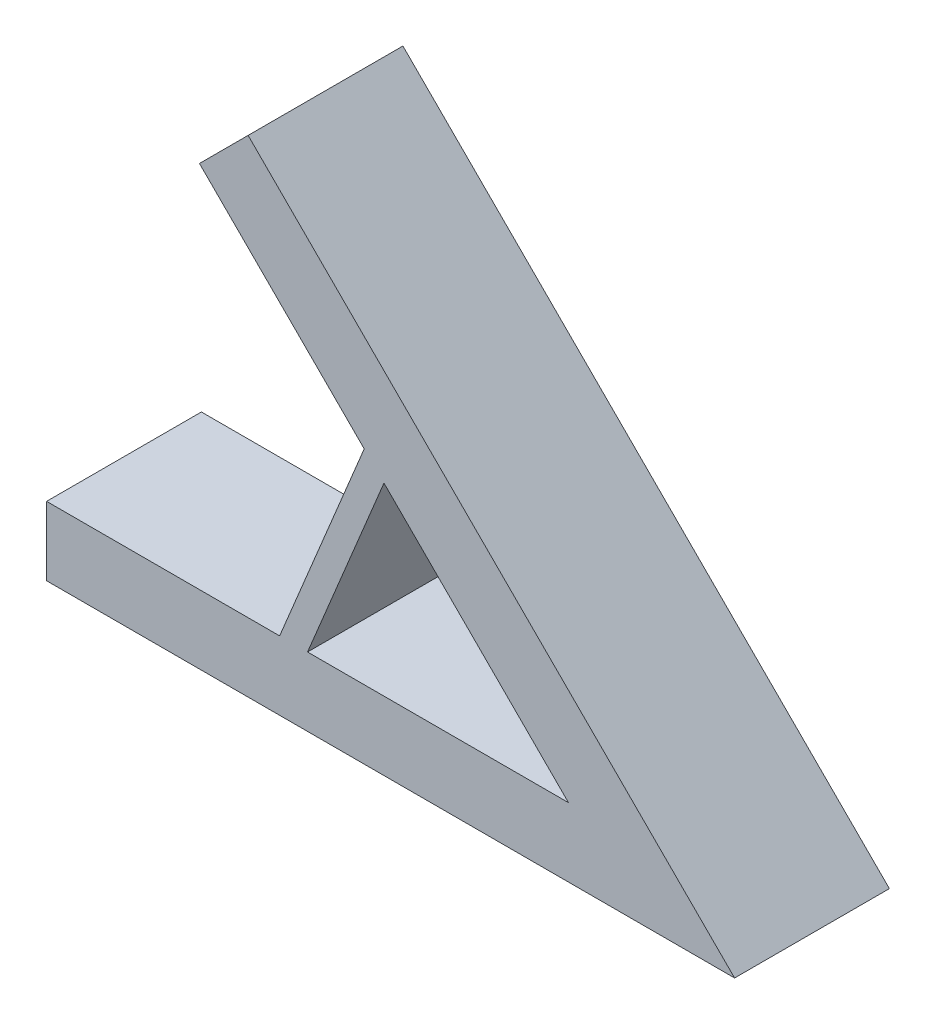
from build123d import *

# Parameters (mm, degrees)
EXTRUDE_1_DEPTH = 18


with BuildPart() as part:
    # 草图1 → 凸台-拉伸1 (new body)
    with BuildSketch(Plane.XY):
        Polygon((-19.313708499, 8), (-80, 8), (-80, 0), (0, 0), (-56.568542495, 56.568542495), (-62.225396744, 50.911688245), align=None)
        Polygon((-43.065653216, 31.751944717), (-52.90403085, 8), (-49.656854249, 8), (-40.769552622, 29.455844123), align=None)
    extrude(amount=EXTRUDE_1_DEPTH)


solid = part.part
